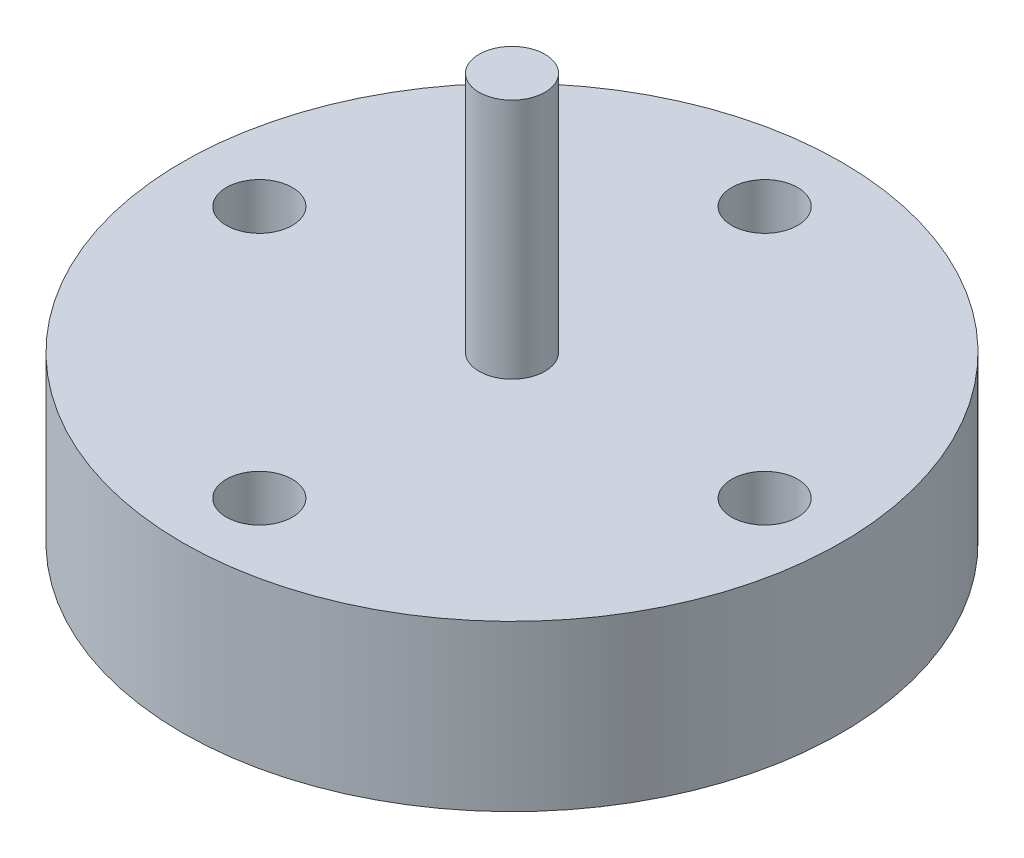
from build123d import *

# Parameters (mm, degrees)
SKETCH1_R           = 15
BOSS_EXTRUDE1_DEPTH = 7.5
SKETCH2_R           = 1.5
BOSS_EXTRUDE2_DEPTH = 11
SKETCH4_R           = 7.5
CUT_EXTRUDE3_DEPTH  = 3.5
SKETCH6_R           = 1.5
CUT_EXTRUDE4_DEPTH  = 24.895606291


with BuildPart() as part:
    # Sketch1 → Boss-Extrude1 (new body)
    with BuildSketch(Plane(origin=(0, 0, 0), x_dir=(1, 0, 0), z_dir=(0, 1, 0))):
        with Locations(Location((0, 0, 0), (0, 0, 270))):
            Circle(SKETCH1_R)
    extrude(amount=BOSS_EXTRUDE1_DEPTH)

    # Sketch2 → Boss-Extrude2 (add)
    with BuildSketch(Plane(origin=(0, 7.5, 0), x_dir=(1, 0, 0), z_dir=(0, 1, 0))):
        with Locations(Location((0, 0, 0), (0, 0, 270))):
            Circle(SKETCH2_R)
    extrude(amount=BOSS_EXTRUDE2_DEPTH)

    # Sketch4 → Cut-Extrude3 (cut)
    with BuildSketch(Plane.XZ):
        with Locations(Location((0, 0, 0), (0, 0, 270))):
            Circle(SKETCH4_R)
    extrude(amount=-CUT_EXTRUDE3_DEPTH, mode=Mode.SUBTRACT)

    # Sketch6 → Cut-Extrude4 (cut, through all)
    with BuildSketch(Plane(origin=(0, 7.5, 0), x_dir=(1, 0, 0), z_dir=(0, 1, 0))):
        with Locations(Location((0, 11.5, 0), (0, 0, 270))):
            Circle(SKETCH6_R)
        with Locations(Location((11.5, 0, 0), (0, 0, 270))):
            Circle(SKETCH6_R)
        with Locations(Location((0, -11.5, 0), (0, 0, 270))):
            Circle(SKETCH6_R)
        with Locations(Location((-11.5, 0, 0), (0, 0, 270))):
            Circle(SKETCH6_R)
    extrude(amount=-CUT_EXTRUDE4_DEPTH, mode=Mode.SUBTRACT)


solid = part.part
